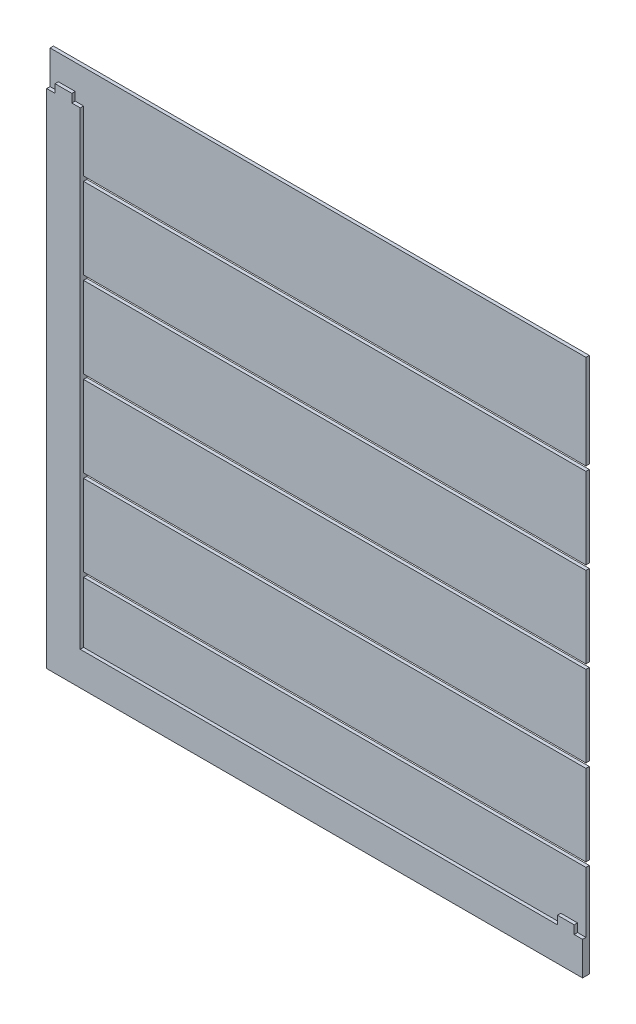
from build123d import *

# Parameters (mm, degrees)
EXTRUDE_1_DEPTH = 1
EXTRUDE_2_DEPTH = 1


with BuildPart() as part:
    # 草图1 → 凸台-拉伸1 (new body)
    with BuildSketch(Plane.XY):
        Polygon((-75, 50.468617295), (-75, 51.868617295), (-65, 51.868617295), (75, 51.868617295), (75, 79.968617295), (-85, 79.968617295), (-85, -80.031382705), (75, -80.031382705), (75, -51.931382705), (-65, -51.931382705), (-75, -51.931382705), (-75, -50.531382705), (-65, -50.531382705), (75, -50.531382705), (75, -26.331382705), (-65, -26.331382705), (-75, -26.331382705), (-75, -24.931382705), (-65, -24.931382705), (75, -24.931382705), (75, -0.731382705), (-65, -0.731382705), (-75, -0.731382705), (-75, 0.668617295), (-65, 0.668617295), (75, 0.668617295), (75, 24.868617295), (-65, 24.868617295), (-75, 24.868617295), (-75, 26.268617295), (-65, 26.268617295), (75, 26.268617295), (75, 50.468617295), (-65, 50.468617295), align=None)
    extrude(amount=EXTRUDE_1_DEPTH)

    # 草图2 → 凸台-拉伸2 (add)
    with BuildSketch(Plane.XY.offset(1)):
        Polygon((-85, -80.031382705), (-85, -70.031382705), (-85, 69.968617295), (-82.5, 69.968617295), (-82.5, 72.468617295), (-77.5, 72.468617295), (-77.5, 69.968617295), (-75, 69.968617295), (-75, -70.031382705), (67.5, -70.031382705), (67.5, -67.531382705), (72.5, -67.531382705), (72.5, -70.031382705), (75, -70.031382705), (75, -80.031382705), align=None)
    extrude(amount=EXTRUDE_2_DEPTH)


solid = part.part
